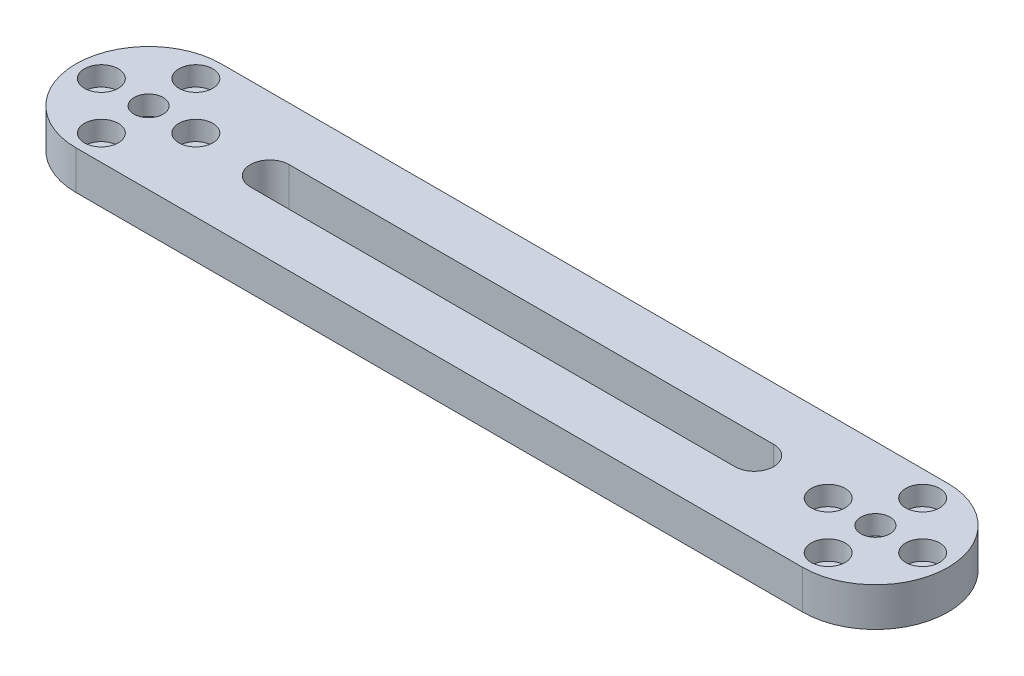
from build123d import *

# Parameters (mm, degrees)
SKETCH_1_R          = 2.1
SKETCH_1_R_2        = 1.6
EXTRUDE_2_DEPTH     = 8
SKETCH_3_R          = 3
SKETCH_3_R_2        = 3.5
CUT_EXTRUDE_2_DEPTH = 4
CUT_EXTRUDE_3_DEPTH = 14


with BuildPart() as part:
    # 草图1 → 凸台-拉伸2 (new body)
    with BuildSketch(Plane(origin=(0, 0, 0), x_dir=(1, 0, 0), z_dir=(0, 1, 0))):
        with BuildLine():
            Line((0, -15), (150, -15))
            ThreePointArc((150, -15), (165, 0), (150, 15))
            Line((150, 15), (0, 15))
            ThreePointArc((0, 15), (-15, 0), (0, -15))
        make_face()
        with Locations(Location((150, -9.75, 0), (0, 0, 270))):
            Circle(SKETCH_1_R, mode=Mode.SUBTRACT)
        with Locations(Location((150, 9.75, 0), (0, 0, 270))):
            Circle(SKETCH_1_R, mode=Mode.SUBTRACT)
        with Locations(Location((0, 9.75, 0), (0, 0, 270))):
            Circle(SKETCH_1_R, mode=Mode.SUBTRACT)
        with Locations(Location((0, -9.75, 0), (0, 0, 270))):
            Circle(SKETCH_1_R, mode=Mode.SUBTRACT)
        with Locations(Location((-9.75, 0, 0), (0, 0, 270))):
            Circle(SKETCH_1_R_2, mode=Mode.SUBTRACT)
        with Locations(Location((9.710485561, 0, 0), (0, 0, 270))):
            Circle(SKETCH_1_R_2, mode=Mode.SUBTRACT)
        with Locations(Location((150, 0, 0), (0, 0, 270))):
            Circle(SKETCH_1_R_2, mode=Mode.SUBTRACT)
        with Locations(Location((0, 0, 0), (0, 0, 270))):
            Circle(SKETCH_1_R_2, mode=Mode.SUBTRACT)
        with Locations(Location((159.75, 0, 0), (0, 0, 270))):
            Circle(SKETCH_1_R_2, mode=Mode.SUBTRACT)
        with Locations(Location((140.289514439, 0, 0), (0, 0, 270))):
            Circle(SKETCH_1_R_2, mode=Mode.SUBTRACT)
    extrude(amount=EXTRUDE_2_DEPTH)

    # 草图3 → 切除-拉伸2 (cut)
    with BuildSketch(Plane(origin=(0, 8, 0), x_dir=(1, 0, 0), z_dir=(0, 1, 0))):
        with Locations(Location((0, 0, 0), (0, 0, 270))):
            Circle(SKETCH_3_R)
        with Locations(Location((0, 9.75, 0), (0, 0, 270))):
            Circle(SKETCH_3_R_2)
        with Locations(Location((9.75, 0, 0), (0, 0, 270))):
            Circle(SKETCH_3_R_2)
        with Locations(Location((0, -9.75, 0), (0, 0, 270))):
            Circle(SKETCH_3_R_2)
        with Locations(Location((-9.75, 0, 0), (0, 0, 270))):
            Circle(SKETCH_3_R_2)
        with Locations(Location((159.75, 0, 0), (0, 0, 90))):
            Circle(SKETCH_3_R_2)
        with Locations(Location((150, -9.75, 0), (0, 0, 90))):
            Circle(SKETCH_3_R_2)
        with Locations(Location((140.25, 0, 0), (0, 0, 90))):
            Circle(SKETCH_3_R_2)
        with Locations(Location((150, 9.75, 0), (0, 0, 90))):
            Circle(SKETCH_3_R_2)
        with Locations(Location((150, 0, 0), (0, 0, 90))):
            Circle(SKETCH_3_R)
    extrude(amount=-CUT_EXTRUDE_2_DEPTH, mode=Mode.SUBTRACT)

    # 草图4 → 切除-拉伸3 (cut)
    with BuildSketch(Plane(origin=(0, 8, 0), x_dir=(1, 0, 0), z_dir=(0, 1, 0))):
        with BuildLine():
            Line((25, 4), (125, 4))
            ThreePointArc((125, 4), (129, 0), (125, -4))
            Line((125, -4), (25, -4))
            ThreePointArc((25, -4), (21, 0), (25, 4))
        make_face()
    extrude(amount=-CUT_EXTRUDE_3_DEPTH, mode=Mode.SUBTRACT)


solid = part.part
